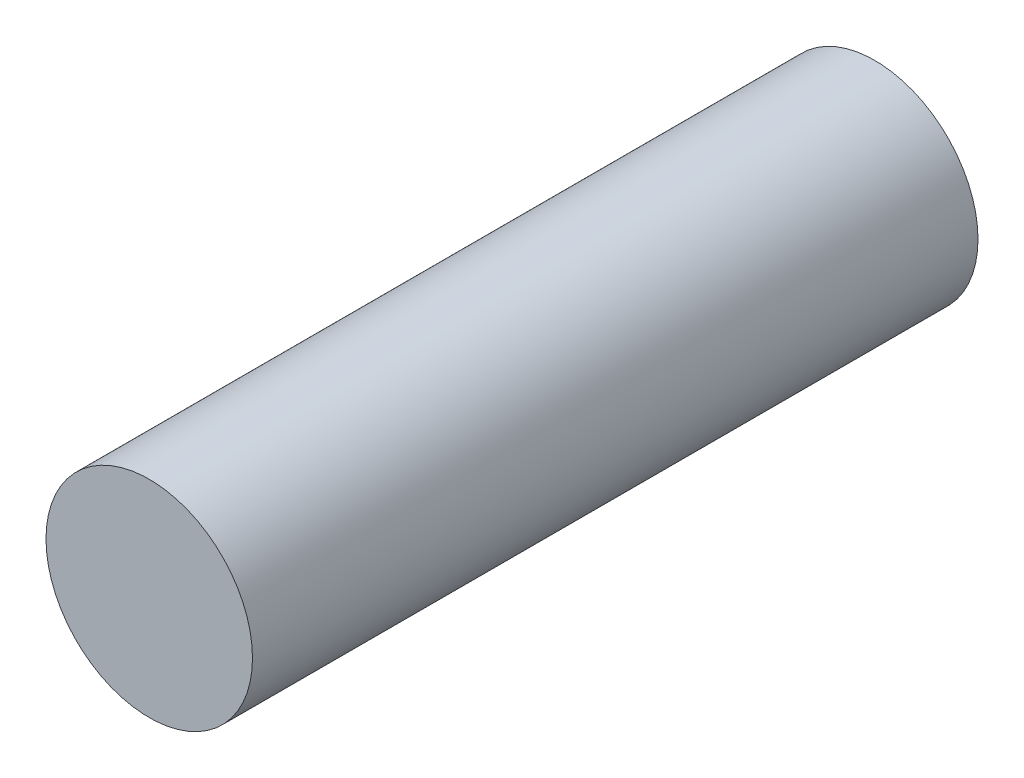
from build123d import *

# Parameters (mm, degrees)
SKETCH_1_R      = 9.25
EXTRUDE_1_DEPTH = 65


with BuildPart() as part:
    # 草圖1 → 填料-伸長1 (new body)
    with BuildSketch(Plane.XY):
        Circle(SKETCH_1_R)
    extrude(amount=EXTRUDE_1_DEPTH)


solid = part.part
